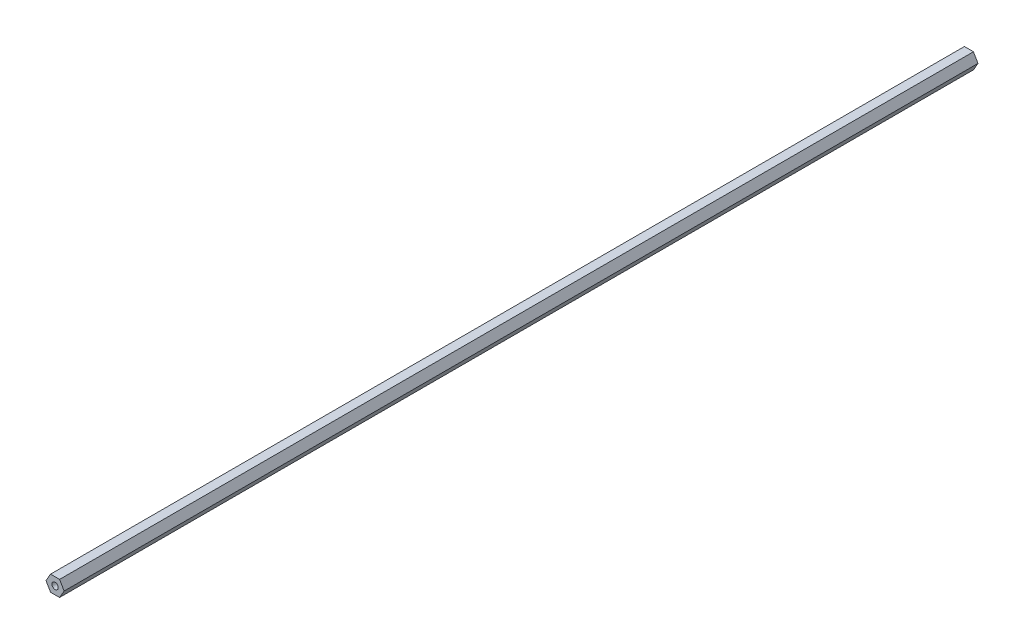
from build123d import *

# Parameters (mm, degrees)
SKETCH1_R           = 2.5527
BOSS_EXTRUDE1_DEPTH = 739.648


with BuildPart() as part:
    # Sketch1 → Boss-Extrude1 (new body)
    with BuildSketch(Plane.XY):
        Polygon((3.666174209, -6.35), (7.332348419, 0), (3.666174209, 6.35), (-3.666174209, 6.35), (-7.332348419, 0), (-3.666174209, -6.35), align=None)
        Circle(SKETCH1_R, mode=Mode.SUBTRACT)
    extrude(amount=BOSS_EXTRUDE1_DEPTH)


solid = part.part
